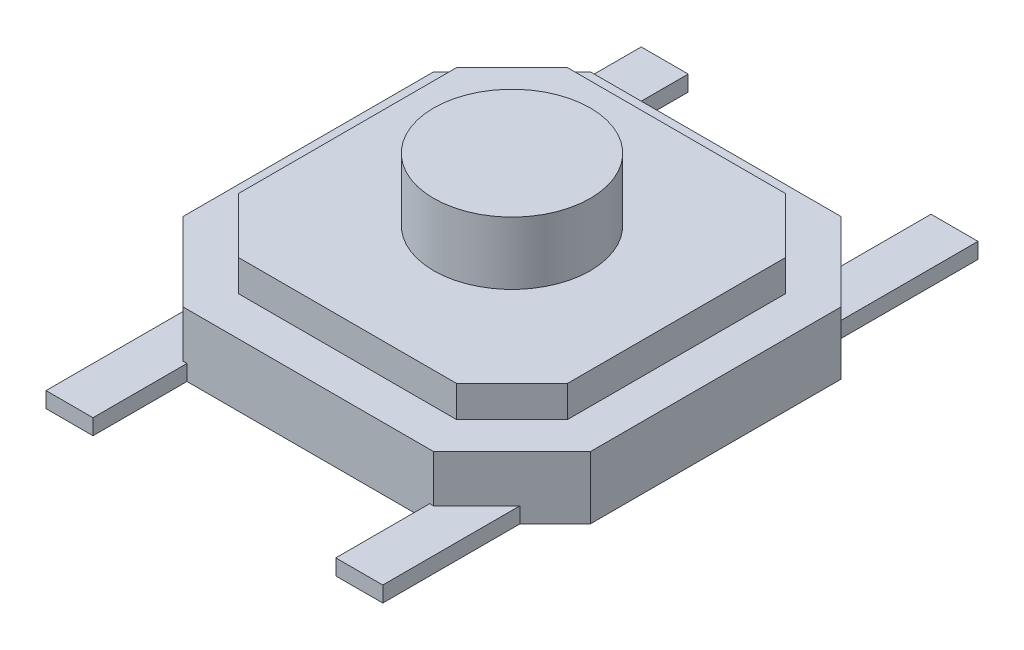
from build123d import *

# Parameters (mm, degrees)
SKETCH_1_W         = 5.2
SKETCH_1_H         = 5.2
EXTRUDE_1_DEPTH    = 0.8
CHAMFER_1_SIZE     = 1
EXTRUDE_1_2_DEPTH  = 0.4
SKETCH_2_R         = 1
EXTRUDE_1111_DEPTH = 0.8
SKETCH_4_W         = 0.6
SKETCH_4_H         = 2.66831223
EXTRUDE_2_DEPTH    = 0.2


with BuildPart() as part:
    # 草图1 → Extrude 1 (new body)
    with BuildSketch(Plane(origin=(0, 0, 0), x_dir=(1, 0, 0), z_dir=(0, 1, 0))):
        Rectangle(SKETCH_1_W, SKETCH_1_H)
    extrude(amount=EXTRUDE_1_DEPTH)

    # 倒角1
    chamfer_1_edges = [part.edges().sort_by_distance(p)[0] for p in [
        (-2.6, 0.4, -2.6),
        (2.6, 0.4, -2.6),
        (2.6, 0.4, 2.6),
        (-2.6, 0.4, 2.6),
    ]]
    chamfer(chamfer_1_edges, length=CHAMFER_1_SIZE)

    # 草图3 → Extrude 1 2 (add)
    with BuildSketch(Plane(origin=(0, 0.8, 0), x_dir=(1, 0, 0), z_dir=(0, 1, 0))):
        Polygon((-2.1, 1.392893219), (-2.1, -1.392893219), (-1.392893219, -2.1), (1.392893219, -2.1), (2.1, -1.392893219), (2.1, 1.392893219), (1.392893219, 2.1), (-1.392893219, 2.1), align=None)
    extrude(amount=EXTRUDE_1_2_DEPTH)

    # 草图2 → Extrude 1111 (add)
    with BuildSketch(Plane(origin=(0, 1.2, 0), x_dir=(-1, 0, 0), z_dir=(0, 1, 0))):
        with Locations(Location((0, 0, 0), (0, 0, 90))):
            Circle(SKETCH_2_R)
    extrude(amount=EXTRUDE_1111_DEPTH)

    # 草图4 → 凸台-拉伸2 (add)
    with BuildSketch(Plane.XZ):
        with Locations((-1.85, 2.465843885)):
            Rectangle(SKETCH_4_W, SKETCH_4_H)
        with Locations((1.85, 2.465843885)):
            Rectangle(SKETCH_4_W, SKETCH_4_H)
        with Locations((1.85, -2.465843885)):
            Rectangle(SKETCH_4_W, SKETCH_4_H)
        with Locations((-1.85, -2.465843885)):
            Rectangle(SKETCH_4_W, SKETCH_4_H)
    extrude(amount=-EXTRUDE_2_DEPTH)


solid = part.part
